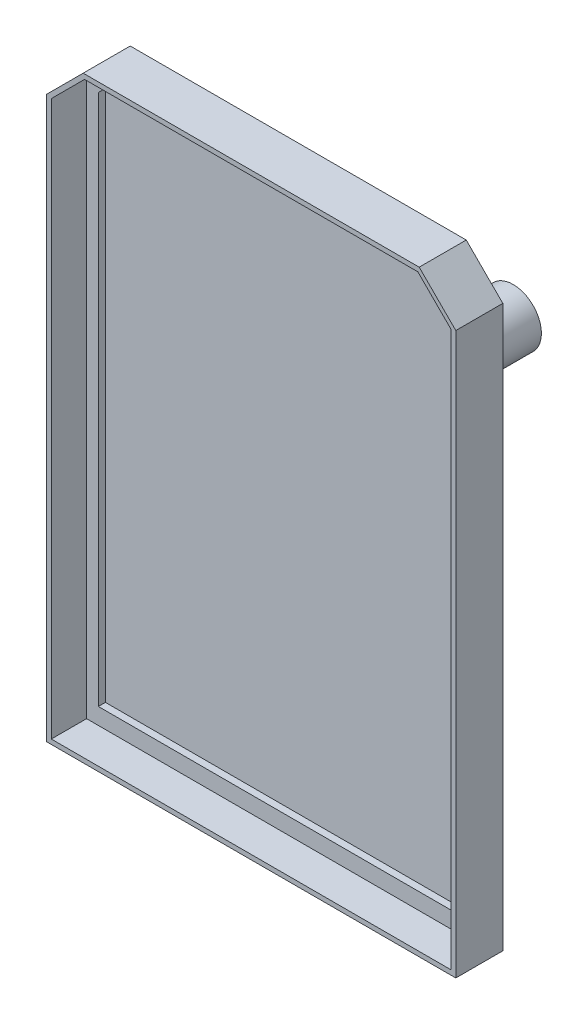
from build123d import *

# Parameters (mm, degrees)
BOSS_EXTRUDE1_DEPTH = 1.5
BOSS_EXTRUDE2_DEPTH = 9
BOSS_EXTRUDE3_DEPTH = 1
SKETCH4_R           = 6
SKETCH4_R_2         = 4.25
BOSS_EXTRUDE4_DEPTH = 50
SKETCH5_R           = 6
SKETCH5_R_2         = 4.25
BOSS_EXTRUDE5_DEPTH = 20
FILLET1_R           = 30


with BuildPart() as part:
    # Sketch1 → Boss-Extrude1 (new body)
    with BuildSketch(Plane(origin=(0, 0, 0), x_dir=(0, 1, 0), z_dir=(0, 0, 1))):
        Polygon((-62.5, -42.5), (-62.5, 42.5), (55.428932188, 42.5), (62.5, 35.428932188), (62.5, -35.428932188), (55.428932188, -42.5), align=None)
        Polygon((54.050252532, 40), (59, 35.050252532), (59, -35.050252532), (54.050252532, -40), (-59, -40), (-59, 40), align=None, mode=Mode.SUBTRACT)
    extrude(amount=BOSS_EXTRUDE1_DEPTH)

    # Sketch2 → Boss-Extrude2 (add)
    with BuildSketch(Plane(origin=(0, 0, 0), x_dir=(0, 1, 0), z_dir=(0, 0, 1))):
        Polygon((-63.5, 43.5), (-63.5, -43.5), (55.721825407, -43.5), (63.5, -35.721825407), (63.5, 35.721825407), (55.721825407, 43.5), align=None)
        Polygon((-62.5, -42.5), (55.428932188, -42.5), (62.5, -35.428932188), (62.5, 35.428932188), (55.428932188, 42.5), (-62.5, 42.5), align=None, mode=Mode.SUBTRACT)
    extrude(amount=BOSS_EXTRUDE2_DEPTH)

    # Sketch3 → Boss-Extrude3 (add)
    with BuildSketch(Plane(origin=(0, 0, 0), x_dir=(0, 1, 0), z_dir=(0, 0, 1))):
        Polygon((55.721825407, 43.5), (-63.5, 43.5), (-63.5, -43.5), (55.721825407, -43.5), (63.5, -35.721825407), (63.5, 35.721825407), align=None)
    extrude(amount=-BOSS_EXTRUDE3_DEPTH)

    # Sketch4 → Boss-Extrude4 (add)
    with BuildSketch(Plane(origin=(0, 0, -1), x_dir=(1, 0, 0), z_dir=(0, 0, -1))):
        with Locations((-4.3, -4.3)):
            Circle(SKETCH4_R)
        with Locations(Location((-4.3, -4.3, 0), (0, 0, 180))):
            Circle(SKETCH4_R_2, mode=Mode.SUBTRACT)
    extrude(amount=BOSS_EXTRUDE4_DEPTH)

    # Sketch5 → Boss-Extrude5 (add)
    with BuildSketch(Plane(origin=(0, 0, -1), x_dir=(1, 0, 0), z_dir=(0, 0, -1))):
        with Locations((-4.3, -4.3)):
            Circle(SKETCH5_R)
        with Locations(Location((-4.3, -4.3, 0), (0, 0, 180))):
            Circle(SKETCH5_R_2, mode=Mode.SUBTRACT)
    extrude(amount=BOSS_EXTRUDE5_DEPTH)

    # Fillet1
    fillet1_edges = [part.edges().sort_by_distance(p)[0] for p in [
        (-10.3, 4.3, -1),
    ]]
    fillet(fillet1_edges, radius=FILLET1_R)


solid = part.part
